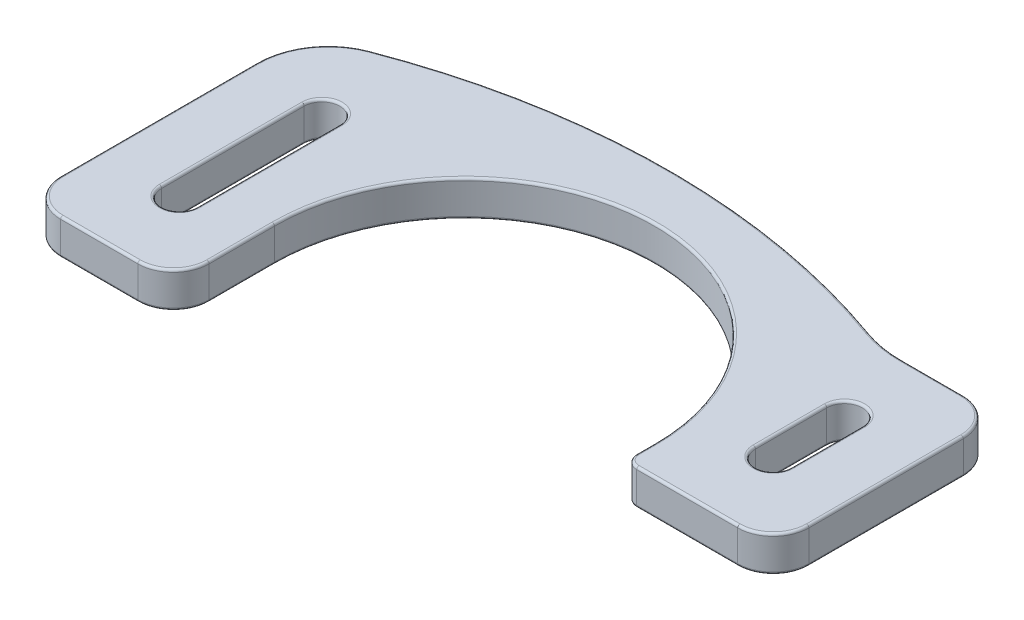
from build123d import *

# Parameters (mm, degrees)
BOSS_EXTRUDE1_DEPTH = 3
FILLET2_R           = 0.2


with BuildPart() as part:
    # Sketch1 → Boss-Extrude1 (new body)
    with BuildSketch(Plane(origin=(0, 0, 0), x_dir=(1, 0, 0), z_dir=(0, 1, 0))):
        with BuildLine():
            Line((28.5, 13.5), (28.5, 0.5))
            ThreePointArc((28.5, 0.5), (27.621320344, -1.621320344), (25.5, -2.5))
            Line((25.5, -2.5), (17, -2.5))
            ThreePointArc((17, -2.5), (16.292893219, -2.207106781), (16, -1.5))
            Line((16, -1.5), (16, 0))
            ThreePointArc((16, 0), (0, 16), (-16, 0))
            Line((-16, 0), (-16, -5.5))
            ThreePointArc((-16, -5.5), (-16.878679656, -7.621320344), (-19, -8.5))
            Line((-19, -8.5), (-25.5, -8.5))
            ThreePointArc((-25.5, -8.5), (-27.621320344, -7.621320344), (-28.5, -5.5))
            Line((-28.5, -5.5), (-28.5, 11.024943981))
            ThreePointArc((-28.5, 11.024943981), (-27.441688248, 14.427842342), (-24.640094248, 16.630298262))
            ThreePointArc((-24.640094248, 16.630298262), (-3.891519175, 20.573208824), (16.937886016, 17.082393637))
            ThreePointArc((16.937886016, 17.082393637), (18.594276649, 16.646674073), (20.300725647, 16.5))
            Line((20.300725647, 16.5), (25.5, 16.5))
            ThreePointArc((25.5, 16.5), (27.621320344, 15.621320344), (28.5, 13.5))
        make_face()
        with BuildLine():
            Line((23.5, 10), (23.5, 4))
            ThreePointArc((23.5, 4), (22, 2.5), (20.5, 4))
            Line((20.5, 4), (20.5, 10))
            ThreePointArc((20.5, 10), (22, 11.5), (23.5, 10))
        make_face(mode=Mode.SUBTRACT)
        with BuildLine():
            Line((-20.5, 10), (-20.5, -2))
            ThreePointArc((-20.5, -2), (-22, -3.5), (-23.5, -2))
            Line((-23.5, -2), (-23.5, 10))
            ThreePointArc((-23.5, 10), (-22, 11.5), (-20.5, 10))
        make_face(mode=Mode.SUBTRACT)
    extrude(amount=BOSS_EXTRUDE1_DEPTH)

    # Fillet2
    fillet2_edges = [part.edges().sort_by_distance(p)[0] for p in [
        (-27.621320344, 3, 7.621320344),
        (-22.25, 3, 8.5),
        (-3.891519175, 0, -20.573208824),
        (18.594276649, 0, -16.646674073),
        (22.900362823, 0, -16.5),
        (27.621320344, 0, -15.621320344),
        (28.5, 0, -7),
        (-16.878679656, 3, 7.621320344),
        (27.621320344, 0, 1.621320344),
        (21.25, 0, 2.5),
        (16.292893219, 0, 2.207106781),
        (16, 0, 0.75),
        (0, 0, -16),
        (-16, 0, 2.75),
        (-16.878679656, 0, 7.621320344),
        (-22.25, 0, 8.5),
        (-16, 3, 2.75),
        (-27.621320344, 0, 7.621320344),
        (-28.5, 0, -2.762471991),
        (-27.441688248, 0, -14.427842342),
        (0, 3, -16),
        (16, 3, 0.75),
        (16.292893219, 3, 2.207106781),
        (21.25, 3, 2.5),
        (27.621320344, 3, 1.621320344),
        (28.5, 3, -7),
        (-27.441688248, 3, -14.427842342),
        (27.621320344, 3, -15.621320344),
        (22, 0, -11.5),
        (20.5, 0, -7),
        (22, 0, -2.5),
        (23.5, 0, -7),
        (22, 3, -11.5),
        (22.900362823, 3, -16.5),
        (20.5, 3, -7),
        (22, 3, -2.5),
        (23.5, 3, -7),
        (18.594276649, 3, -16.646674073),
        (-3.891519175, 3, -20.573208824),
        (-22, 0, -11.5),
        (-23.5, 0, -4),
        (-22, 0, 3.5),
        (-20.5, 0, -4),
        (-22, 3, -11.5),
        (-23.5, 3, -4),
        (-22, 3, 3.5),
        (-20.5, 3, -4),
        (-28.5, 3, -2.762471991),
    ]]
    fillet(fillet2_edges, radius=FILLET2_R)


solid = part.part
